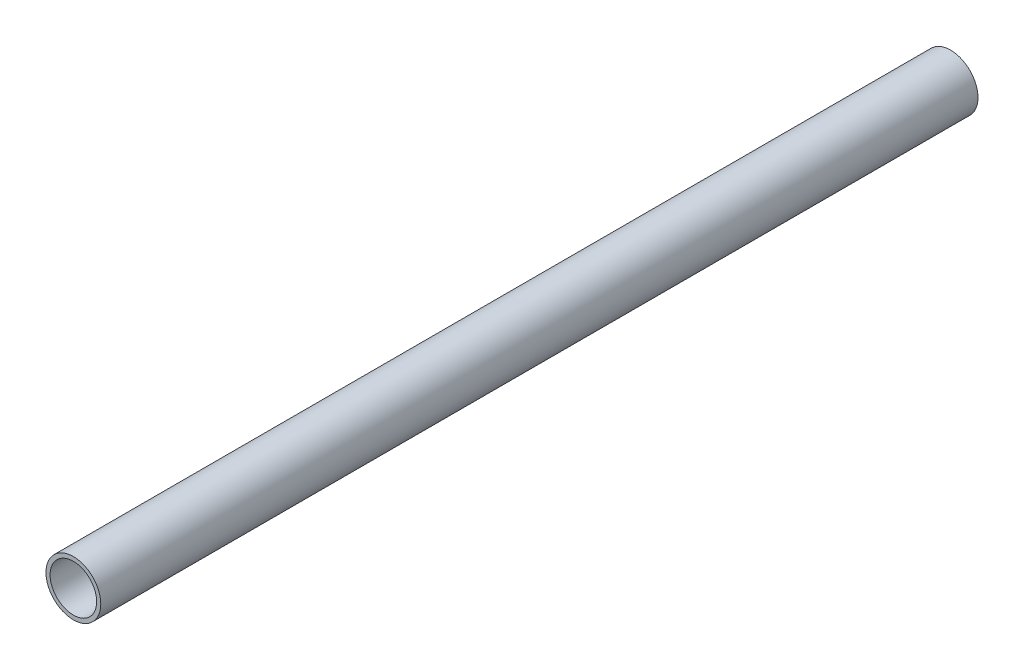
from build123d import *

# Parameters (mm, degrees)
PIPESKETCH_R    = 10
PIPESKETCH_R_2  = 8.5
EXTRUSION_DEPTH = 320


with BuildPart() as part:
    # PipeSketch → Extrusion (new body)
    with BuildSketch(Plane.XY):
        Circle(PIPESKETCH_R)
        Circle(PIPESKETCH_R_2, mode=Mode.SUBTRACT)
    extrude(amount=EXTRUSION_DEPTH)


solid = part.part
